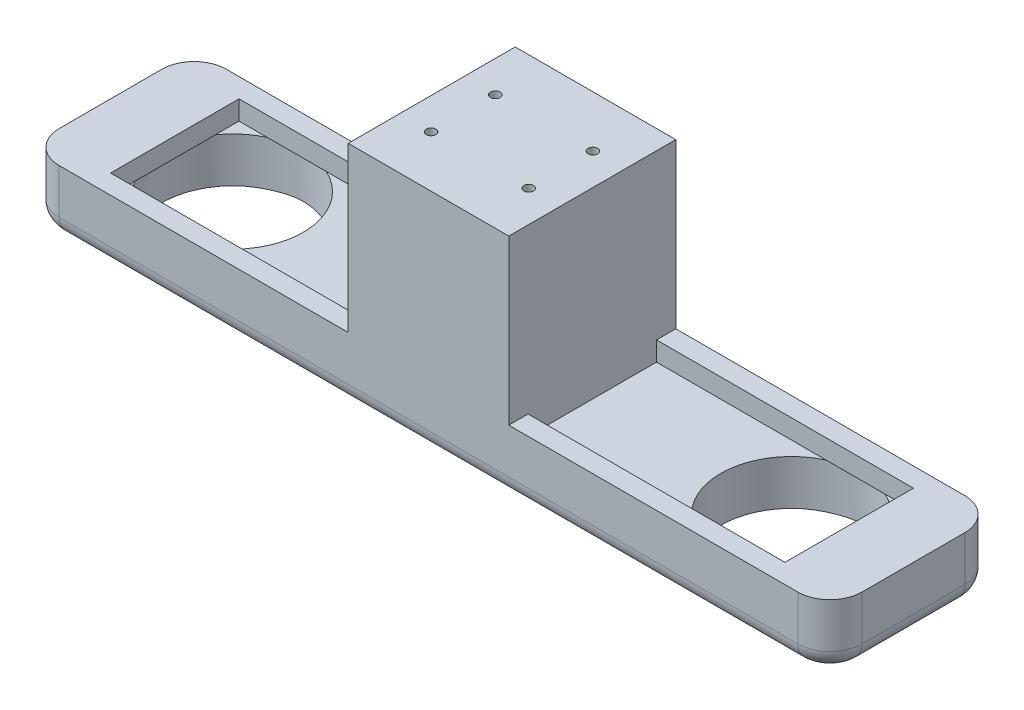
from build123d import *

# Parameters (mm, degrees)
SKETCH1_W                 = 125
SKETCH1_H                 = 26
BOSS_EXTRUDE1_DEPTH       = 10
SKETCH2_W                 = 25
SKETCH2_H                 = 26
BOSS_EXTRUDE2_DEPTH       = 27.5
FILLET3_R                 = 5
FILLET4_R                 = 3
SKETCH3_W                 = 40
SKETCH3_H                 = 20
CUT_EXTRUDE2_DEPTH        = 2
SKETCH5_W                 = 40
SKETCH5_H                 = 20
CUT_EXTRUDE3_DEPTH        = 2
SKETCH6_R                 = 11
CUT_EXTRUDE5_DEPTH        = 7
SKETCH7_R                 = 11
CUT_EXTRUDE6_DEPTH        = 7
SKETCH8_W                 = 25
SKETCH8_H                 = 26
CUT_EXTRUDE7_DEPTH        = 2
SKETCH9_W                 = 40
SKETCH9_H                 = 20
CUT_EXTRUDE8_DEPTH        = 1
F_1_5MM_DOWEL_HOLE1_D     = 1.5
F_1_5MM_DOWEL_HOLE1_DEPTH = 8
F_1_5MM_DOWEL_HOLE1_TIP   = 0.450645464


with BuildPart() as part:
    # Sketch1 → Boss-Extrude1 (new body)
    with BuildSketch(Plane(origin=(0, 0, 0), x_dir=(1, 0, 0), z_dir=(0, 1, 0))):
        with Locations((62.5, 13)):
            Rectangle(SKETCH1_W, SKETCH1_H)
    extrude(amount=BOSS_EXTRUDE1_DEPTH)

    # Sketch2 → Boss-Extrude2 (add)
    with BuildSketch(Plane(origin=(0, 10, 0), x_dir=(1, 0, 0), z_dir=(0, 1, 0))):
        with Locations((62.5, 13)):
            Rectangle(SKETCH2_W, SKETCH2_H)
    extrude(amount=BOSS_EXTRUDE2_DEPTH)

    # Fillet3
    fillet3_edges = [part.edges().sort_by_distance(p)[0] for p in [
        (0, 5, -26),
        (125, 5, -26),
        (125, 5, 0),
        (0, 5, 0),
    ]]
    fillet(fillet3_edges, radius=FILLET3_R)

    # Fillet4
    fillet4_edges = [part.edges().sort_by_distance(p)[0] for p in [
        (62.5, 0, 0),
        (0, 0, -13),
        (62.5, 0, -26),
        (125, 0, -13),
        (123.535533906, 0, -1.464466094),
        (123.535533906, 0, -24.535533906),
        (1.464466094, 0, -24.535533906),
        (1.464466094, 0, -1.464466094),
    ]]
    fillet(fillet4_edges, radius=FILLET4_R)

    # Sketch3 → Cut-Extrude2 (cut)
    with BuildSketch(Plane(origin=(0, 10, 0), x_dir=(1, 0, 0), z_dir=(0, 1, 0))):
        with Locations((30, 13)):
            Rectangle(SKETCH3_W, SKETCH3_H)
    extrude(amount=-CUT_EXTRUDE2_DEPTH, mode=Mode.SUBTRACT)

    # Sketch5 → Cut-Extrude3 (cut)
    with BuildSketch(Plane(origin=(0, 10, 0), x_dir=(1, 0, 0), z_dir=(0, 1, 0))):
        with Locations((95, 13)):
            Rectangle(SKETCH5_W, SKETCH5_H)
    extrude(amount=-CUT_EXTRUDE3_DEPTH, mode=Mode.SUBTRACT)

    # Sketch6 → Cut-Extrude5 (cut)
    with BuildSketch(Plane(origin=(0, 0, 0), x_dir=(-1, 0, 0), z_dir=(0, -1, 0))):
        with Locations(Location((-19, 13, 0), (0, 0, 90))):
            Circle(SKETCH6_R)
    extrude(amount=-CUT_EXTRUDE5_DEPTH, mode=Mode.SUBTRACT)

    # Sketch7 → Cut-Extrude6 (cut)
    with BuildSketch(Plane(origin=(0, 0, 0), x_dir=(-1, 0, 0), z_dir=(0, -1, 0))):
        with Locations(Location((-106, 13, 0), (0, 0, 90))):
            Circle(SKETCH7_R)
    extrude(amount=-CUT_EXTRUDE6_DEPTH, mode=Mode.SUBTRACT)

    # Sketch8 → Cut-Extrude7 (cut)
    with BuildSketch(Plane(origin=(0, 37.5, 0), x_dir=(1, 0, 0), z_dir=(0, 1, 0))):
        with Locations((62.5, 13)):
            Rectangle(SKETCH8_W, SKETCH8_H)
    extrude(amount=-CUT_EXTRUDE7_DEPTH, mode=Mode.SUBTRACT)

    # Sketch9 → Cut-Extrude8 (cut)
    with BuildSketch(Plane(origin=(0, 8, 0), x_dir=(1, 0, 0), z_dir=(0, 1, 0))):
        with Locations((30, 13)):
            Rectangle(SKETCH9_W, SKETCH9_H)
        with Locations((95, 13)):
            Rectangle(SKETCH9_W, SKETCH9_H)
    extrude(amount=-CUT_EXTRUDE8_DEPTH, mode=Mode.SUBTRACT)

    # Ø1.5mm Dowel Hole1
    with Locations(Plane(origin=(54.9, 35.5, -18), x_dir=(0, 0, 1), z_dir=(0, 1, 0))):
        with Locations((0, 0), (0, 15.2), (10, 15.2), (10, 0)):
            Hole(F_1_5MM_DOWEL_HOLE1_D / 2, depth=F_1_5MM_DOWEL_HOLE1_DEPTH)
            with Locations((0, 0, -(F_1_5MM_DOWEL_HOLE1_DEPTH + F_1_5MM_DOWEL_HOLE1_TIP / 2))):  # 118° drill point
                Cone(0, F_1_5MM_DOWEL_HOLE1_D / 2, F_1_5MM_DOWEL_HOLE1_TIP, mode=Mode.SUBTRACT)


solid = part.part
